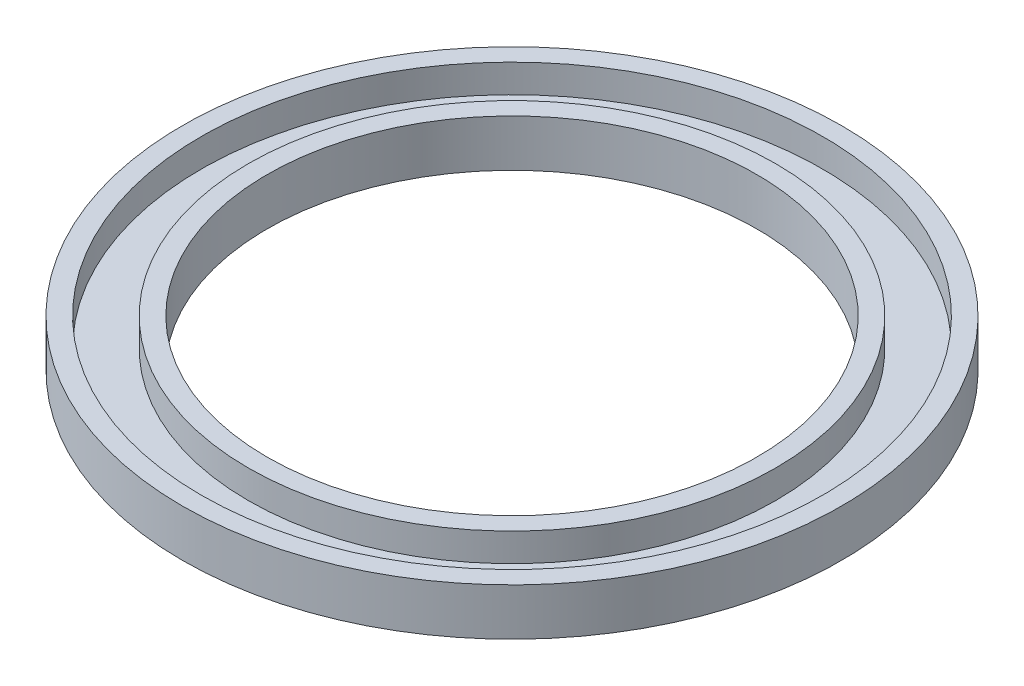
from build123d import *

# Parameters (mm, degrees)
SKETCH_1_R          = 17.5
EXTRUDE_1_DEPTH     = 2.5
SKETCH_2_R          = 13
CUT_EXTRUDE_1_DEPTH = 2.5
SKETCH_3_R          = 16.5
SKETCH_3_R_2        = 14
CUT_EXTRUDE_2_DEPTH = 1.5


with BuildPart() as part:
    # 草图1 → 凸台-拉伸1 (new body)
    with BuildSketch(Plane(origin=(0, 0, 0), x_dir=(1, 0, 0), z_dir=(0, 1, 0))):
        with Locations(Location((0, 0, 0), (0, 0, 270))):
            Circle(SKETCH_1_R)
    extrude(amount=EXTRUDE_1_DEPTH)

    # 草图2 → 切除-拉伸1 (cut)
    with BuildSketch(Plane(origin=(0, 2.5, 0), x_dir=(1, 0, 0), z_dir=(0, 1, 0))):
        with Locations(Location((0, 0, 0), (0, 0, 270))):
            Circle(SKETCH_2_R)
    extrude(amount=-CUT_EXTRUDE_1_DEPTH, mode=Mode.SUBTRACT)

    # 草图3 → 切除-拉伸2 (cut)
    with BuildSketch(Plane(origin=(0, 2.5, 0), x_dir=(1, 0, 0), z_dir=(0, 1, 0))):
        with Locations(Location((0, 0, 0), (0, 0, 270))):
            Circle(SKETCH_3_R)
        with Locations(Location((0, 0, 0), (0, 0, 270))):
            Circle(SKETCH_3_R_2, mode=Mode.SUBTRACT)
    extrude(amount=-CUT_EXTRUDE_2_DEPTH, mode=Mode.SUBTRACT)


solid = part.part
